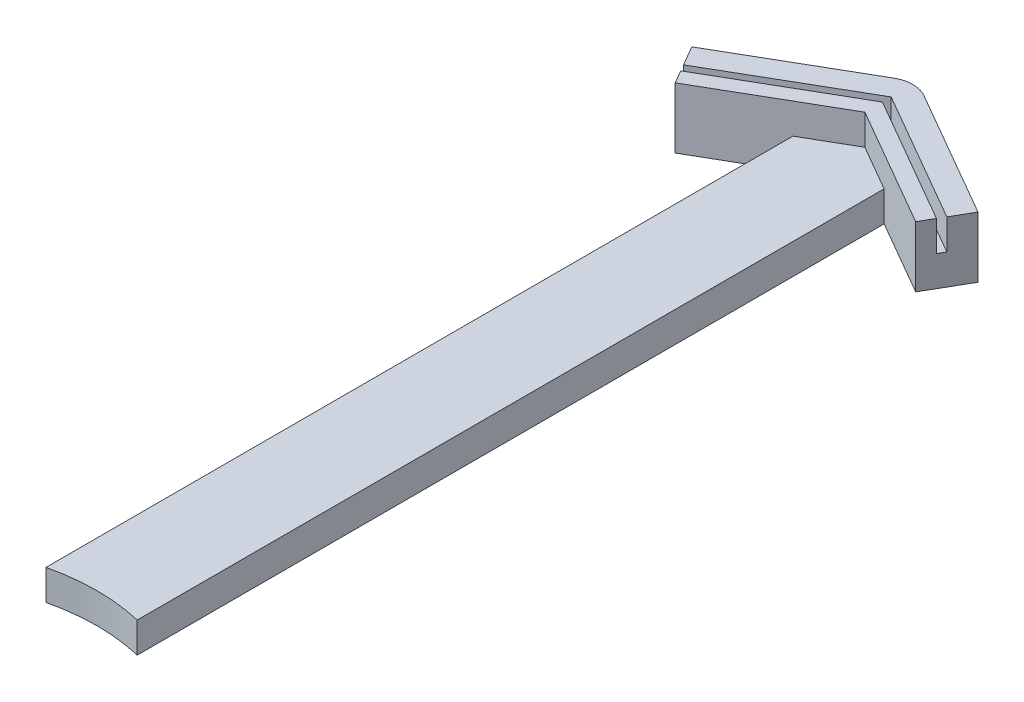
from build123d import *

# Parameters (mm, degrees)
BOSS_EXTRUDE1_DEPTH = 40
CUT_EXTRUDE1_DEPTH  = 20
BOSS_EXTRUDE2_DEPTH = 20


with BuildPart() as part:
    # Sketch1 → Boss-Extrude1 (new body)
    with BuildSketch(Plane(origin=(0, 0, 0), x_dir=(1, 0, 0), z_dir=(0, 1, 0))):
        with BuildLine():
            Line((10, -5.773502692), (94.102760382, -54.330254038))
            Line((94.102760382, -54.330254038), (79.102760382, -80.311016151))
            Line((79.102760382, -80.311016151), (0, -34.641016151))
            Line((0, -34.641016151), (-79.102760382, -80.311016151))
            Line((-79.102760382, -80.311016151), (-94.102760382, -54.330254038))
            Line((-94.102760382, -54.330254038), (-10, -5.773502692))
            ThreePointArc((-10, -5.773502692), (0, -3.094010768), (10, -5.773502692))
        make_face()
    extrude(amount=BOSS_EXTRUDE1_DEPTH)

    # Sketch2 → Cut-Extrude1 (cut)
    with BuildSketch(Plane(origin=(0, 40, 0), x_dir=(1, 0, 0), z_dir=(0, 1, 0))):
        Polygon((-86.602760382, -67.320635095), (0, -17.320508076), (86.602760382, -67.320635095), (84.102760382, -71.650762114), (0, -23.094010768), (-84.102760382, -71.650762114), align=None)
    extrude(amount=-CUT_EXTRUDE1_DEPTH, mode=Mode.SUBTRACT)


with BuildPart() as body_2:
    # Sketch3 → Boss-Extrude2 (new body)
    with BuildSketch(Plane.XZ):
        with BuildLine():
            Line((-30, 51.961524227), (0, 34.641016151))
            Line((0, 34.641016151), (30, 51.961524227))
            Line((30, 51.961524227), (30, 543.235205853))
            ThreePointArc((30, 543.235205853), (0, 539.72631226), (-30, 543.235205853))
            Line((-30, 543.235205853), (-30, 51.961524227))
        make_face()
    extrude(amount=-BOSS_EXTRUDE2_DEPTH)


solid = Compound([part.part, body_2.part])
